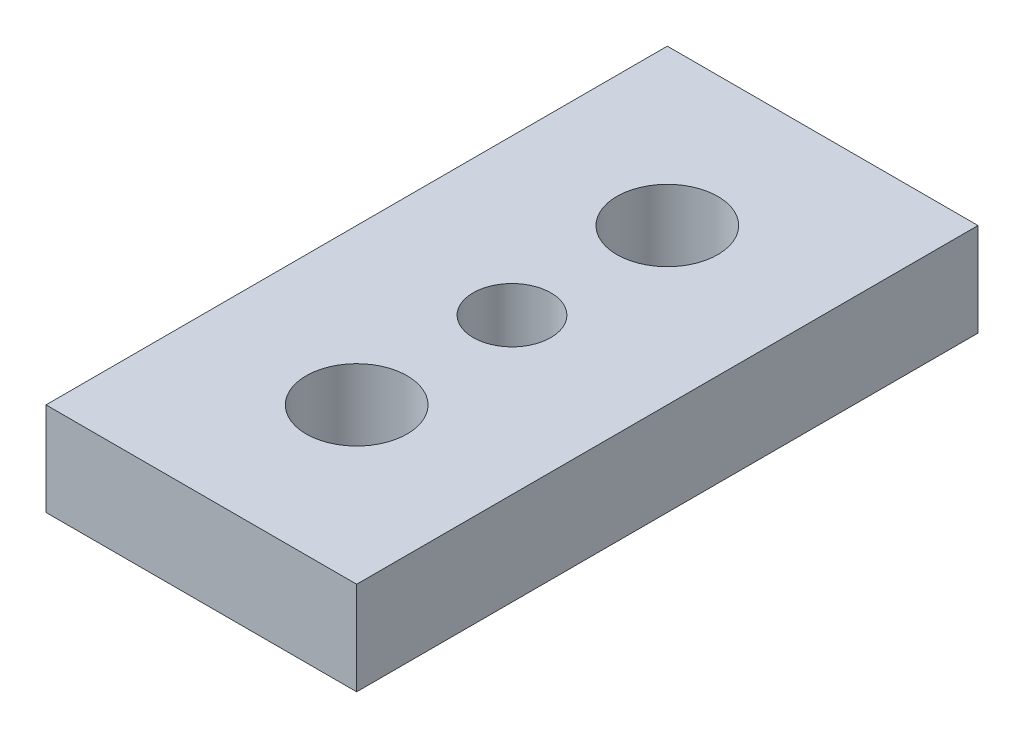
from build123d import *

# Parameters (mm, degrees)
SKETCH_1_W         = 20
SKETCH_1_H         = 40
SKETCH_1_R         = 3.25
EXTRUDE_1_DEPTH    = 6
HOLE_WIZARD_M6_1_D = 5


with BuildPart() as part:
    # 草图1 → 凸台-拉伸1 (new body)
    with BuildSketch(Plane(origin=(0, 0, 0), x_dir=(1, 0, 0), z_dir=(0, 1, 0))):
        with Locations((10, 20)):
            Rectangle(SKETCH_1_W, SKETCH_1_H)
        with Locations(Location((10, 30, 0), (0, 0, 270))):
            Circle(SKETCH_1_R, mode=Mode.SUBTRACT)
        with Locations(Location((10, 10, 0), (0, 0, 270))):
            Circle(SKETCH_1_R, mode=Mode.SUBTRACT)
    extrude(amount=EXTRUDE_1_DEPTH)

    # M6 螺纹孔1 (through all)
    with Locations(Plane(origin=(10, 6, -20), x_dir=(0, 0, 1), z_dir=(0, 1, 0))):
        with Locations((0, 0)):
            Hole(HOLE_WIZARD_M6_1_D / 2)


solid = part.part
